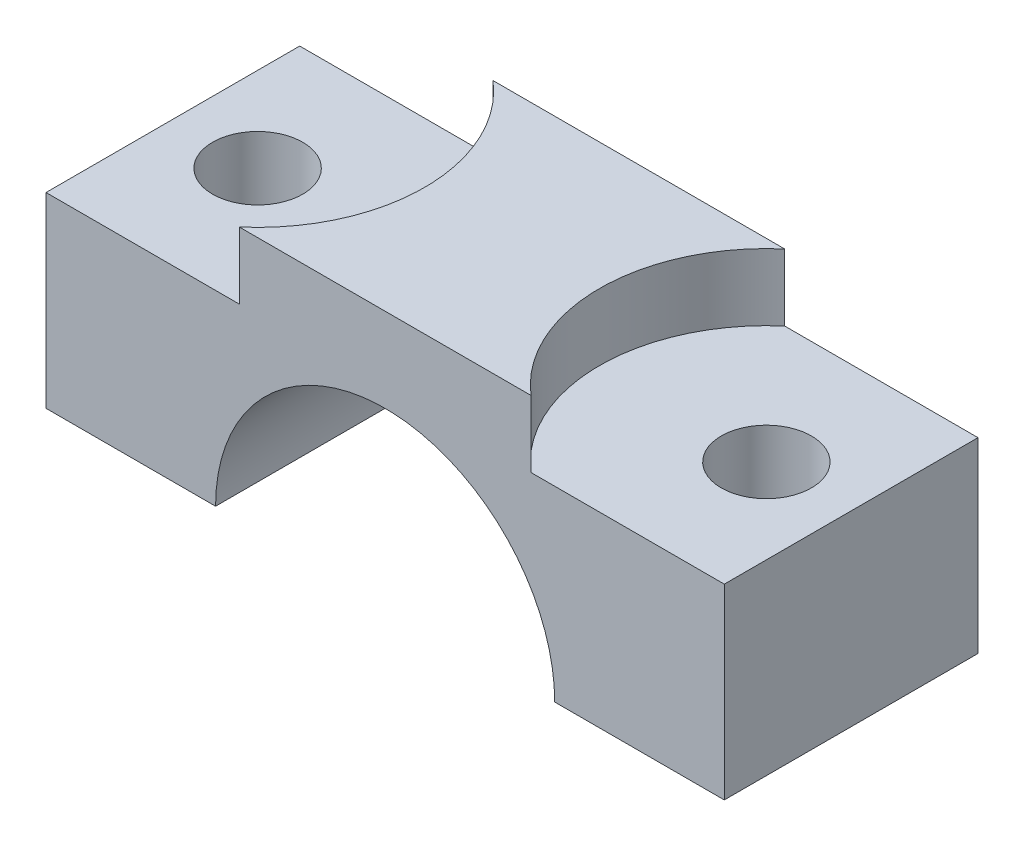
from build123d import *

# Parameters (mm, degrees)
BOSS_EXTRUDE1_DEPTH = 9.5
SKETCH3_R           = 12.5
CUT_EXTRUDE1_DEPTH  = 5
SKETCH4_R           = 3.375
CUT_EXTRUDE2_DEPTH  = 31.519010469


with BuildPart() as part:
    # Sketch1 → Boss-Extrude1 (new, symmetric)
    with BuildSketch(Plane.XY):
        with BuildLine():
            Line((-25.4, 0), (-25.4, 19))
            Line((-25.4, 19), (25.4, 19))
            Line((25.4, 19), (25.4, 0))
            Line((25.4, 0), (12.7, 0))
            ThreePointArc((12.7, 0), (0, 12.7), (-12.7, 0))
            Line((-12.7, 0), (-25.4, 0))
        make_face()
    extrude(amount=BOSS_EXTRUDE1_DEPTH, both=True)

    # Sketch3 → Cut-Extrude1 (cut)
    with BuildSketch(Plane(origin=(0, 19, 0), x_dir=(1, 0, 0), z_dir=(0, 1, 0))):
        with Locations((-19.05, 0)):
            Circle(SKETCH3_R)
        with Locations((19.05, 0)):
            Circle(SKETCH3_R)
    extrude(amount=-CUT_EXTRUDE1_DEPTH, mode=Mode.SUBTRACT)

    # Sketch4 → Cut-Extrude2 (cut, through all)
    with BuildSketch(Plane(origin=(0, 14, 0), x_dir=(1, 0, 0), z_dir=(0, 1, 0))):
        with Locations(Location((-19.05, 0, 0), (0, 0, 270))):
            Circle(SKETCH4_R)
        with Locations(Location((19.05, 0, 0), (0, 0, 270))):
            Circle(SKETCH4_R)
    extrude(amount=-CUT_EXTRUDE2_DEPTH, mode=Mode.SUBTRACT)


solid = part.part
